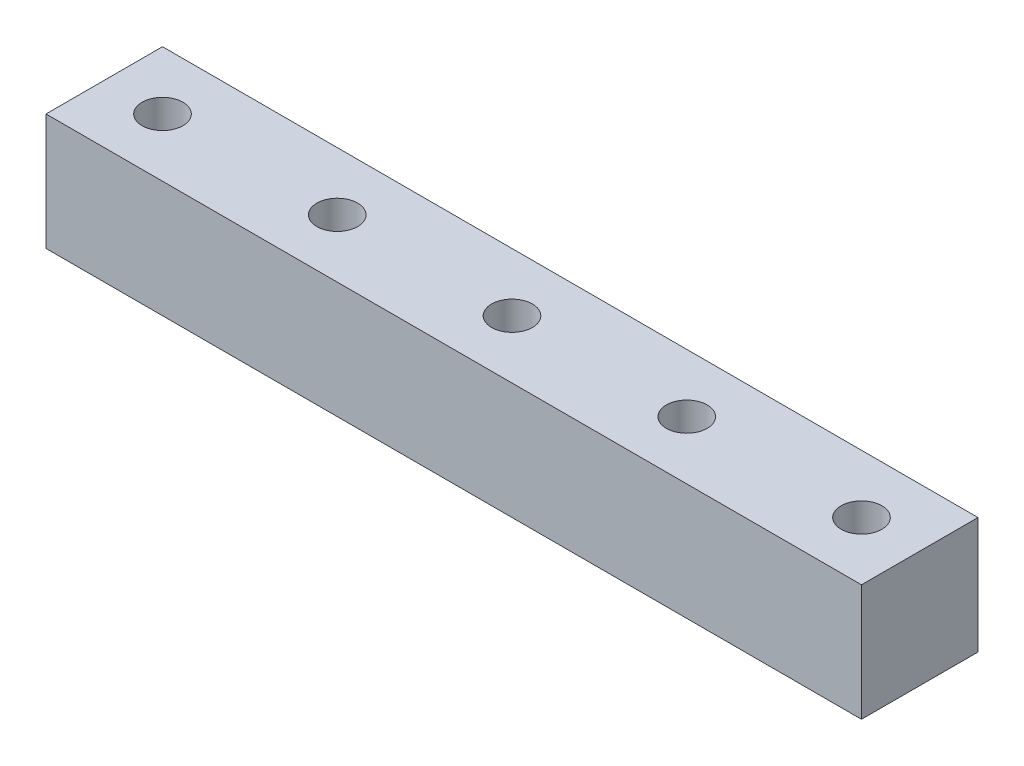
from build123d import *

# Parameters (mm, degrees)
SKETCH1_W           = 140
SKETCH1_H           = 20
SKETCH1_R           = 3.5
BOSS_EXTRUDE1_DEPTH = 20


with BuildPart() as part:
    # Sketch1 → Boss-Extrude1 (new body)
    with BuildSketch(Plane(origin=(0, 0, 0), x_dir=(1, 0, 0), z_dir=(0, 1, 0))):
        Rectangle(SKETCH1_W, SKETCH1_H)
        with Locations(Location((-60, 0, 0), (0, 0, 270))):
            Circle(SKETCH1_R, mode=Mode.SUBTRACT)
        with Locations(Location((-30, 0, 0), (0, 0, 270))):
            Circle(SKETCH1_R, mode=Mode.SUBTRACT)
        with Locations(Location((0, 0, 0), (0, 0, 270))):
            Circle(SKETCH1_R, mode=Mode.SUBTRACT)
        with Locations(Location((30, 0, 0), (0, 0, 270))):
            Circle(SKETCH1_R, mode=Mode.SUBTRACT)
        with Locations(Location((60, 0, 0), (0, 0, 270))):
            Circle(SKETCH1_R, mode=Mode.SUBTRACT)
    extrude(amount=BOSS_EXTRUDE1_DEPTH)


solid = part.part
